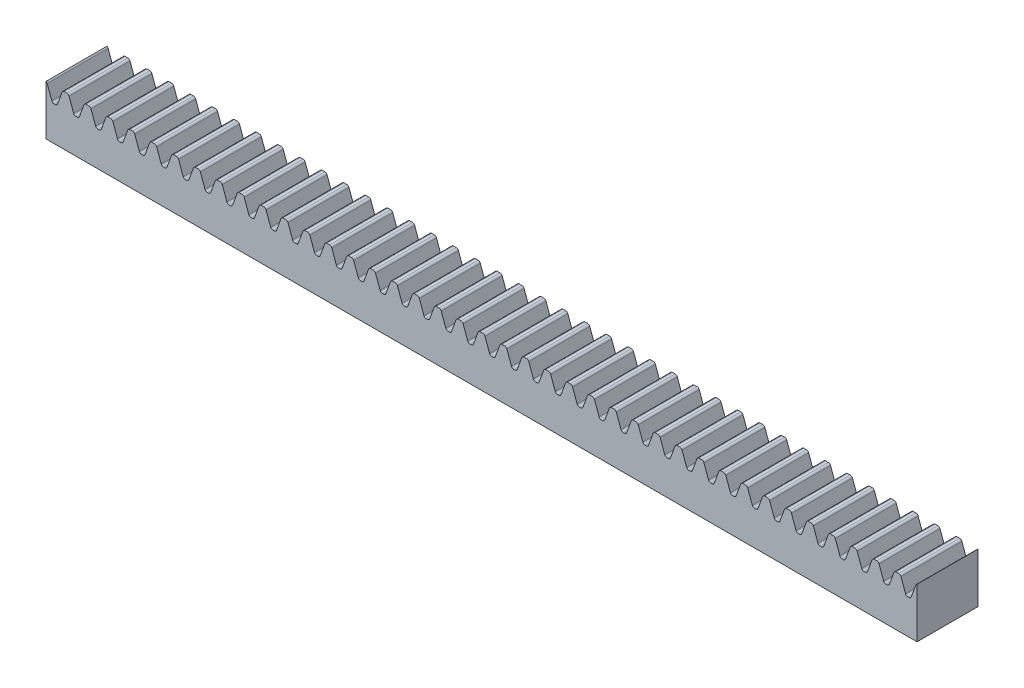
from build123d import *

# Parameters (mm, degrees)
BOSS_EXTRUDE1_DEPTH      = 4
BOSS_EXTRUDE1_DEPTH_BACK = 4
SKETCH3_W                = 100
SKETCH3_H                = 12.3
CUT_EXTRUDE1_DEPTH       = 51.535358908
LPATTERN1_COUNT          = 40
LPATTERN1_PITCH          = 2.513274123
LPATTERN1_COUNT_DIR2     = 2
LPATTERN1_PITCH_DIR2     = 2.513274123
SKETCH5_W                = 100
SKETCH5_H                = 8
CUT_EXTRUDE2_DEPTH       = 6.55
CUT_EXTRUDE3_START       = -1
CUT_EXTRUDE3_DEPTH       = 1


with BuildPart() as part:
    # Sketch3 → Boss-Extrude1 (new, two sides: drawn at the far end of the back side and taken through both)
    with BuildSketch(Plane.XY.offset(-BOSS_EXTRUDE1_DEPTH_BACK)):
        Rectangle(SKETCH3_W, SKETCH3_H)
    extrude(amount=BOSS_EXTRUDE1_DEPTH + BOSS_EXTRUDE1_DEPTH_BACK)

    # Sketch4 → Cut-Extrude1 (cut, symmetric)
    with BuildSketch(Plane.XY):
        with BuildLine():
            Line((-48.153629439, 5.973395556), (-48.089350678, 6.15))
            Line((-48.089350678, 6.15), (-49.008845396, 6.15))
            Line((-49.008845396, 6.15), (-49.008845396, 4.35))
            Line((-49.008845396, 4.35), (-48.932435624, 4.35))
            ThreePointArc((-48.932435624, 4.35), (-48.778485397, 4.39854032), (-48.680218339, 4.526604444))
            Line((-48.680218339, 4.526604444), (-48.153629439, 5.973395556))
        make_face()
        with BuildLine():
            Line((-47.901412154, 6.15), (-48.089350678, 6.15))
            Line((-48.089350678, 6.15), (-48.153629439, 5.973395556))
            ThreePointArc((-48.153629439, 5.973395556), (-48.05536238, 6.10145968), (-47.901412154, 6.15))
        make_face()
        with BuildLine():
            Line((-47.35078723, 5.973395556), (-47.415065991, 6.15))
            Line((-47.415065991, 6.15), (-47.603004515, 6.15))
            ThreePointArc((-47.603004515, 6.15), (-47.449054289, 6.10145968), (-47.35078723, 5.973395556))
        make_face()
        with BuildLine():
            Line((-46.495571273, 4.35), (-46.495571273, 6.15))
            Line((-46.495571273, 6.15), (-47.415065991, 6.15))
            Line((-47.415065991, 6.15), (-47.35078723, 5.973395556))
            Line((-47.35078723, 5.973395556), (-46.824198331, 4.526604444))
            ThreePointArc((-46.824198331, 4.526604444), (-46.725931272, 4.39854032), (-46.571981045, 4.35))
            Line((-46.571981045, 4.35), (-46.495571273, 4.35))
        make_face()
    cut_extrude1 = extrude(amount=CUT_EXTRUDE1_DEPTH, both=True, mode=Mode.SUBTRACT)

    # LPattern1: Cut-Extrude1 40 × 2
    with Locations(*[Vector(1, 0, 0) * (i * LPATTERN1_PITCH) + Vector(-1, 0, 0) * (j * LPATTERN1_PITCH_DIR2) for i in range(LPATTERN1_COUNT) for j in range(LPATTERN1_COUNT_DIR2) if (i, j) != (0, 0)]):
        add(cut_extrude1, mode=Mode.SUBTRACT)

    # Sketch5 → Cut-Extrude2 (cut)
    with BuildSketch(Plane.XZ.offset(6.15)):
        Rectangle(SKETCH5_W, SKETCH5_H)
    extrude(amount=-CUT_EXTRUDE2_DEPTH, mode=Mode.SUBTRACT)

    # Sketch6 → Cut-Extrude3 (cut)
    with BuildSketch(Plane(origin=(0, 0, -4), x_dir=(-1, 0, 0), z_dir=(0, 0, -1)).offset(CUT_EXTRUDE3_START)):
        with BuildLine():
            Line((-50, 0.4), (50, 0.4))
            Line((50, 0.4), (50, 6.123505047))
            ThreePointArc((50, 6.123505047), (49.917330087, 6.061763106), (49.864061353, 5.973395556))
            Line((49.864061353, 5.973395556), (49.337472453, 4.526604444))
            ThreePointArc((49.337472453, 4.526604444), (49.239205395, 4.39854032), (49.085255168, 4.35))
            Line((49.085255168, 4.35), (48.932435624, 4.35))
            ThreePointArc((48.932435624, 4.35), (48.778485397, 4.39854032), (48.680218339, 4.526604444))
            Line((48.680218339, 4.526604444), (48.153629439, 5.973395556))
            ThreePointArc((48.153629439, 5.973395556), (48.05536238, 6.10145968), (47.901412154, 6.15))
            Line((47.901412154, 6.15), (47.603004515, 6.15))
            ThreePointArc((47.603004515, 6.15), (47.449054289, 6.10145968), (47.35078723, 5.973395556))
            Line((47.35078723, 5.973395556), (46.824198331, 4.526604444))
            ThreePointArc((46.824198331, 4.526604444), (46.725931272, 4.39854032), (46.571981045, 4.35))
            Line((46.571981045, 4.35), (46.419161501, 4.35))
            ThreePointArc((46.419161501, 4.35), (46.265211275, 4.39854032), (46.166944216, 4.526604444))
            Line((46.166944216, 4.526604444), (45.640355316, 5.973395556))
            ThreePointArc((45.640355316, 5.973395556), (45.542088257, 6.10145968), (45.388138031, 6.15))
            Line((45.388138031, 6.15), (45.089730393, 6.15))
            ThreePointArc((45.089730393, 6.15), (44.935780166, 6.10145968), (44.837513107, 5.973395556))
            Line((44.837513107, 5.973395556), (44.310924208, 4.526604444))
            ThreePointArc((44.310924208, 4.526604444), (44.212657149, 4.39854032), (44.058706923, 4.35))
            Line((44.058706923, 4.35), (43.905887378, 4.35))
            ThreePointArc((43.905887378, 4.35), (43.751937152, 4.39854032), (43.653670093, 4.526604444))
            Line((43.653670093, 4.526604444), (43.127081193, 5.973395556))
            ThreePointArc((43.127081193, 5.973395556), (43.028814134, 6.10145968), (42.874863908, 6.15))
            Line((42.874863908, 6.15), (42.57645627, 6.15))
            ThreePointArc((42.57645627, 6.15), (42.422506043, 6.10145968), (42.324238985, 5.973395556))
            Line((42.324238985, 5.973395556), (41.797650085, 4.526604444))
            ThreePointArc((41.797650085, 4.526604444), (41.699383026, 4.39854032), (41.5454328, 4.35))
            Line((41.5454328, 4.35), (41.392613255, 4.35))
            ThreePointArc((41.392613255, 4.35), (41.238663029, 4.39854032), (41.14039597, 4.526604444))
            Line((41.14039597, 4.526604444), (40.61380707, 5.973395556))
            ThreePointArc((40.61380707, 5.973395556), (40.515540011, 6.10145968), (40.361589785, 6.15))
            Line((40.361589785, 6.15), (40.063182147, 6.15))
            ThreePointArc((40.063182147, 6.15), (39.909231921, 6.10145968), (39.810964862, 5.973395556))
            Line((39.810964862, 5.973395556), (39.284375962, 4.526604444))
            ThreePointArc((39.284375962, 4.526604444), (39.186108903, 4.39854032), (39.032158677, 4.35))
            Line((39.032158677, 4.35), (38.879339132, 4.35))
            ThreePointArc((38.879339132, 4.35), (38.725388906, 4.39854032), (38.627121847, 4.526604444))
            Line((38.627121847, 4.526604444), (38.100532947, 5.973395556))
            ThreePointArc((38.100532947, 5.973395556), (38.002265888, 6.10145968), (37.848315662, 6.15))
            Line((37.848315662, 6.15), (37.549908024, 6.15))
            ThreePointArc((37.549908024, 6.15), (37.395957798, 6.10145968), (37.297690739, 5.973395556))
            Line((37.297690739, 5.973395556), (36.771101839, 4.526604444))
            ThreePointArc((36.771101839, 4.526604444), (36.67283478, 4.39854032), (36.518884554, 4.35))
            Line((36.518884554, 4.35), (36.366065009, 4.35))
            ThreePointArc((36.366065009, 4.35), (36.212114783, 4.39854032), (36.113847724, 4.526604444))
            Line((36.113847724, 4.526604444), (35.587258824, 5.973395556))
            ThreePointArc((35.587258824, 5.973395556), (35.488991766, 6.10145968), (35.335041539, 6.15))
            Line((35.335041539, 6.15), (35.036633901, 6.15))
            ThreePointArc((35.036633901, 6.15), (34.882683675, 6.10145968), (34.784416616, 5.973395556))
            Line((34.784416616, 5.973395556), (34.257827716, 4.526604444))
            ThreePointArc((34.257827716, 4.526604444), (34.159560657, 4.39854032), (34.005610431, 4.35))
            Line((34.005610431, 4.35), (33.852790886, 4.35))
            ThreePointArc((33.852790886, 4.35), (33.69884066, 4.39854032), (33.600573601, 4.526604444))
            Line((33.600573601, 4.526604444), (33.073984702, 5.973395556))
            ThreePointArc((33.073984702, 5.973395556), (32.975717643, 6.10145968), (32.821767416, 6.15))
            Line((32.821767416, 6.15), (32.523359778, 6.15))
            ThreePointArc((32.523359778, 6.15), (32.369409552, 6.10145968), (32.271142493, 5.973395556))
            Line((32.271142493, 5.973395556), (31.744553593, 4.526604444))
            ThreePointArc((31.744553593, 4.526604444), (31.646286534, 4.39854032), (31.492336308, 4.35))
            Line((31.492336308, 4.35), (31.339516764, 4.35))
            ThreePointArc((31.339516764, 4.35), (31.185566537, 4.39854032), (31.087299478, 4.526604444))
            Line((31.087299478, 4.526604444), (30.560710579, 5.973395556))
            ThreePointArc((30.560710579, 5.973395556), (30.46244352, 6.10145968), (30.308493294, 6.15))
            Line((30.308493294, 6.15), (30.010085655, 6.15))
            ThreePointArc((30.010085655, 6.15), (29.856135429, 6.10145968), (29.75786837, 5.973395556))
            Line((29.75786837, 5.973395556), (29.23127947, 4.526604444))
            ThreePointArc((29.23127947, 4.526604444), (29.133012412, 4.39854032), (28.979062185, 4.35))
            Line((28.979062185, 4.35), (28.826242641, 4.35))
            ThreePointArc((28.826242641, 4.35), (28.672292414, 4.39854032), (28.574025356, 4.526604444))
            Line((28.574025356, 4.526604444), (28.047436456, 5.973395556))
            ThreePointArc((28.047436456, 5.973395556), (27.949169397, 6.10145968), (27.795219171, 6.15))
            Line((27.795219171, 6.15), (27.496811532, 6.15))
            ThreePointArc((27.496811532, 6.15), (27.342861306, 6.10145968), (27.244594247, 5.973395556))
            Line((27.244594247, 5.973395556), (26.718005348, 4.526604444))
            ThreePointArc((26.718005348, 4.526604444), (26.619738289, 4.39854032), (26.465788062, 4.35))
            Line((26.465788062, 4.35), (26.312968518, 4.35))
            ThreePointArc((26.312968518, 4.35), (26.159018292, 4.39854032), (26.060751233, 4.526604444))
            Line((26.060751233, 4.526604444), (25.534162333, 5.973395556))
            ThreePointArc((25.534162333, 5.973395556), (25.435895274, 6.10145968), (25.281945048, 6.15))
            Line((25.281945048, 6.15), (24.98353741, 6.15))
            ThreePointArc((24.98353741, 6.15), (24.829587183, 6.10145968), (24.731320124, 5.973395556))
            Line((24.731320124, 5.973395556), (24.204731225, 4.526604444))
            ThreePointArc((24.204731225, 4.526604444), (24.106464166, 4.39854032), (23.95251394, 4.35))
            Line((23.95251394, 4.35), (23.799694395, 4.35))
            ThreePointArc((23.799694395, 4.35), (23.645744169, 4.39854032), (23.54747711, 4.526604444))
            Line((23.54747711, 4.526604444), (23.02088821, 5.973395556))
            ThreePointArc((23.02088821, 5.973395556), (22.922621151, 6.10145968), (22.768670925, 6.15))
            Line((22.768670925, 6.15), (22.470263287, 6.15))
            ThreePointArc((22.470263287, 6.15), (22.31631306, 6.10145968), (22.218046002, 5.973395556))
            Line((22.218046002, 5.973395556), (21.691457102, 4.526604444))
            ThreePointArc((21.691457102, 4.526604444), (21.593190043, 4.39854032), (21.439239817, 4.35))
            Line((21.439239817, 4.35), (21.286420272, 4.35))
            ThreePointArc((21.286420272, 4.35), (21.132470046, 4.39854032), (21.034202987, 4.526604444))
            Line((21.034202987, 4.526604444), (20.507614087, 5.973395556))
            ThreePointArc((20.507614087, 5.973395556), (20.409347028, 6.10145968), (20.255396802, 6.15))
            Line((20.255396802, 6.15), (19.956989164, 6.15))
            ThreePointArc((19.956989164, 6.15), (19.803038938, 6.10145968), (19.704771879, 5.973395556))
            Line((19.704771879, 5.973395556), (19.178182979, 4.526604444))
            ThreePointArc((19.178182979, 4.526604444), (19.07991592, 4.39854032), (18.925965694, 4.35))
            Line((18.925965694, 4.35), (18.773146149, 4.35))
            ThreePointArc((18.773146149, 4.35), (18.619195923, 4.39854032), (18.520928864, 4.526604444))
            Line((18.520928864, 4.526604444), (17.994339964, 5.973395556))
            ThreePointArc((17.994339964, 5.973395556), (17.896072906, 6.10145968), (17.742122679, 6.15))
            Line((17.742122679, 6.15), (17.443715041, 6.15))
            ThreePointArc((17.443715041, 6.15), (17.289764815, 6.10145968), (17.191497756, 5.973395556))
            Line((17.191497756, 5.973395556), (16.664908856, 4.526604444))
            ThreePointArc((16.664908856, 4.526604444), (16.566641797, 4.39854032), (16.412691571, 4.35))
            Line((16.412691571, 4.35), (16.259872026, 4.35))
            ThreePointArc((16.259872026, 4.35), (16.1059218, 4.39854032), (16.007654741, 4.526604444))
            Line((16.007654741, 4.526604444), (15.481065842, 5.973395556))
            ThreePointArc((15.481065842, 5.973395556), (15.382798783, 6.10145968), (15.228848556, 6.15))
            Line((15.228848556, 6.15), (14.930440918, 6.15))
            ThreePointArc((14.930440918, 6.15), (14.776490692, 6.10145968), (14.678223633, 5.973395556))
            Line((14.678223633, 5.973395556), (14.151634733, 4.526604444))
            ThreePointArc((14.151634733, 4.526604444), (14.053367674, 4.39854032), (13.899417448, 4.35))
            Line((13.899417448, 4.35), (13.746597904, 4.35))
            ThreePointArc((13.746597904, 4.35), (13.592647677, 4.39854032), (13.494380618, 4.526604444))
            Line((13.494380618, 4.526604444), (12.967791719, 5.973395556))
            ThreePointArc((12.967791719, 5.973395556), (12.86952466, 6.10145968), (12.715574434, 6.15))
            Line((12.715574434, 6.15), (12.417166795, 6.15))
            ThreePointArc((12.417166795, 6.15), (12.263216569, 6.10145968), (12.16494951, 5.973395556))
            Line((12.16494951, 5.973395556), (11.63836061, 4.526604444))
            ThreePointArc((11.63836061, 4.526604444), (11.540093551, 4.39854032), (11.386143325, 4.35))
            Line((11.386143325, 4.35), (11.233323781, 4.35))
            ThreePointArc((11.233323781, 4.35), (11.079373554, 4.39854032), (10.981106496, 4.526604444))
            Line((10.981106496, 4.526604444), (10.454517596, 5.973395556))
            ThreePointArc((10.454517596, 5.973395556), (10.356250537, 6.10145968), (10.202300311, 6.15))
            Line((10.202300311, 6.15), (9.903892672, 6.15))
            ThreePointArc((9.903892672, 6.15), (9.749942446, 6.10145968), (9.651675387, 5.973395556))
            Line((9.651675387, 5.973395556), (9.125086487, 4.526604444))
            ThreePointArc((9.125086487, 4.526604444), (9.026819429, 4.39854032), (8.872869202, 4.35))
            Line((8.872869202, 4.35), (8.720049658, 4.35))
            ThreePointArc((8.720049658, 4.35), (8.566099431, 4.39854032), (8.467832373, 4.526604444))
            Line((8.467832373, 4.526604444), (7.941243473, 5.973395556))
            ThreePointArc((7.941243473, 5.973395556), (7.842976414, 6.10145968), (7.689026188, 6.15))
            Line((7.689026188, 6.15), (7.390618549, 6.15))
            ThreePointArc((7.390618549, 6.15), (7.236668323, 6.10145968), (7.138401264, 5.973395556))
            Line((7.138401264, 5.973395556), (6.611812365, 4.526604444))
            ThreePointArc((6.611812365, 4.526604444), (6.513545306, 4.39854032), (6.359595079, 4.35))
            Line((6.359595079, 4.35), (6.206775535, 4.35))
            ThreePointArc((6.206775535, 4.35), (6.052825309, 4.39854032), (5.95455825, 4.526604444))
            Line((5.95455825, 4.526604444), (5.42796935, 5.973395556))
            ThreePointArc((5.42796935, 5.973395556), (5.329702291, 6.10145968), (5.175752065, 6.15))
            Line((5.175752065, 6.15), (4.877344427, 6.15))
            ThreePointArc((4.877344427, 6.15), (4.7233942, 6.10145968), (4.625127141, 5.973395556))
            Line((4.625127141, 5.973395556), (4.098538242, 4.526604444))
            ThreePointArc((4.098538242, 4.526604444), (4.000271183, 4.39854032), (3.846320957, 4.35))
            Line((3.846320957, 4.35), (3.693501412, 4.35))
            ThreePointArc((3.693501412, 4.35), (3.539551186, 4.39854032), (3.441284127, 4.526604444))
            Line((3.441284127, 4.526604444), (2.914695227, 5.973395556))
            ThreePointArc((2.914695227, 5.973395556), (2.816428168, 6.10145968), (2.662477942, 6.15))
            Line((2.662477942, 6.15), (2.364070304, 6.15))
            ThreePointArc((2.364070304, 6.15), (2.210120077, 6.10145968), (2.111853019, 5.973395556))
            Line((2.111853019, 5.973395556), (1.585264119, 4.526604444))
            ThreePointArc((1.585264119, 4.526604444), (1.48699706, 4.39854032), (1.333046834, 4.35))
            Line((1.333046834, 4.35), (1.180227289, 4.35))
            ThreePointArc((1.180227289, 4.35), (1.026277063, 4.39854032), (0.928010004, 4.526604444))
            Line((0.928010004, 4.526604444), (0.401421104, 5.973395556))
            ThreePointArc((0.401421104, 5.973395556), (0.303154045, 6.10145968), (0.149203819, 6.15))
            Line((0.149203819, 6.15), (-0.149203819, 6.15))
            ThreePointArc((-0.149203819, 6.15), (-0.303154045, 6.10145968), (-0.401421104, 5.973395556))
            Line((-0.401421104, 5.973395556), (-0.928010004, 4.526604444))
            ThreePointArc((-0.928010004, 4.526604444), (-1.026277063, 4.39854032), (-1.180227289, 4.35))
            Line((-1.180227289, 4.35), (-1.333046834, 4.35))
            ThreePointArc((-1.333046834, 4.35), (-1.48699706, 4.39854032), (-1.585264119, 4.526604444))
            Line((-1.585264119, 4.526604444), (-2.111853019, 5.973395556))
            ThreePointArc((-2.111853019, 5.973395556), (-2.210120077, 6.10145968), (-2.364070304, 6.15))
            Line((-2.364070304, 6.15), (-2.662477942, 6.15))
            ThreePointArc((-2.662477942, 6.15), (-2.816428168, 6.10145968), (-2.914695227, 5.973395556))
            Line((-2.914695227, 5.973395556), (-3.441284127, 4.526604444))
            ThreePointArc((-3.441284127, 4.526604444), (-3.539551186, 4.39854032), (-3.693501412, 4.35))
            Line((-3.693501412, 4.35), (-3.846320957, 4.35))
            ThreePointArc((-3.846320957, 4.35), (-4.000271183, 4.39854032), (-4.098538242, 4.526604444))
            Line((-4.098538242, 4.526604444), (-4.625127141, 5.973395556))
            ThreePointArc((-4.625127141, 5.973395556), (-4.7233942, 6.10145968), (-4.877344427, 6.15))
            Line((-4.877344427, 6.15), (-5.175752065, 6.15))
            ThreePointArc((-5.175752065, 6.15), (-5.329702291, 6.10145968), (-5.42796935, 5.973395556))
            Line((-5.42796935, 5.973395556), (-5.95455825, 4.526604444))
            ThreePointArc((-5.95455825, 4.526604444), (-6.052825309, 4.39854032), (-6.206775535, 4.35))
            Line((-6.206775535, 4.35), (-6.359595079, 4.35))
            ThreePointArc((-6.359595079, 4.35), (-6.513545306, 4.39854032), (-6.611812365, 4.526604444))
            Line((-6.611812365, 4.526604444), (-7.138401264, 5.973395556))
            ThreePointArc((-7.138401264, 5.973395556), (-7.236668323, 6.10145968), (-7.390618549, 6.15))
            Line((-7.390618549, 6.15), (-7.689026188, 6.15))
            ThreePointArc((-7.689026188, 6.15), (-7.842976414, 6.10145968), (-7.941243473, 5.973395556))
            Line((-7.941243473, 5.973395556), (-8.467832373, 4.526604444))
            ThreePointArc((-8.467832373, 4.526604444), (-8.566099431, 4.39854032), (-8.720049658, 4.35))
            Line((-8.720049658, 4.35), (-8.872869202, 4.35))
            ThreePointArc((-8.872869202, 4.35), (-9.026819429, 4.39854032), (-9.125086487, 4.526604444))
            Line((-9.125086487, 4.526604444), (-9.651675387, 5.973395556))
            ThreePointArc((-9.651675387, 5.973395556), (-9.749942446, 6.10145968), (-9.903892672, 6.15))
            Line((-9.903892672, 6.15), (-10.202300311, 6.15))
            ThreePointArc((-10.202300311, 6.15), (-10.356250537, 6.10145968), (-10.454517596, 5.973395556))
            Line((-10.454517596, 5.973395556), (-10.981106496, 4.526604444))
            ThreePointArc((-10.981106496, 4.526604444), (-11.079373554, 4.39854032), (-11.233323781, 4.35))
            Line((-11.233323781, 4.35), (-11.386143325, 4.35))
            ThreePointArc((-11.386143325, 4.35), (-11.540093551, 4.39854032), (-11.63836061, 4.526604444))
            Line((-11.63836061, 4.526604444), (-12.16494951, 5.973395556))
            ThreePointArc((-12.16494951, 5.973395556), (-12.263216569, 6.10145968), (-12.417166795, 6.15))
            Line((-12.417166795, 6.15), (-12.715574434, 6.15))
            ThreePointArc((-12.715574434, 6.15), (-12.86952466, 6.10145968), (-12.967791719, 5.973395556))
            Line((-12.967791719, 5.973395556), (-13.494380618, 4.526604444))
            ThreePointArc((-13.494380618, 4.526604444), (-13.592647677, 4.39854032), (-13.746597904, 4.35))
            Line((-13.746597904, 4.35), (-13.899417448, 4.35))
            ThreePointArc((-13.899417448, 4.35), (-14.053367674, 4.39854032), (-14.151634733, 4.526604444))
            Line((-14.151634733, 4.526604444), (-14.678223633, 5.973395556))
            ThreePointArc((-14.678223633, 5.973395556), (-14.776490692, 6.10145968), (-14.930440918, 6.15))
            Line((-14.930440918, 6.15), (-15.228848556, 6.15))
            ThreePointArc((-15.228848556, 6.15), (-15.382798783, 6.10145968), (-15.481065842, 5.973395556))
            Line((-15.481065842, 5.973395556), (-16.007654741, 4.526604444))
            ThreePointArc((-16.007654741, 4.526604444), (-16.1059218, 4.39854032), (-16.259872026, 4.35))
            Line((-16.259872026, 4.35), (-16.412691571, 4.35))
            ThreePointArc((-16.412691571, 4.35), (-16.566641797, 4.39854032), (-16.664908856, 4.526604444))
            Line((-16.664908856, 4.526604444), (-17.191497756, 5.973395556))
            ThreePointArc((-17.191497756, 5.973395556), (-17.289764815, 6.10145968), (-17.443715041, 6.15))
            Line((-17.443715041, 6.15), (-17.742122679, 6.15))
            ThreePointArc((-17.742122679, 6.15), (-17.896072906, 6.10145968), (-17.994339964, 5.973395556))
            Line((-17.994339964, 5.973395556), (-18.520928864, 4.526604444))
            ThreePointArc((-18.520928864, 4.526604444), (-18.619195923, 4.39854032), (-18.773146149, 4.35))
            Line((-18.773146149, 4.35), (-18.925965694, 4.35))
            ThreePointArc((-18.925965694, 4.35), (-19.07991592, 4.39854032), (-19.178182979, 4.526604444))
            Line((-19.178182979, 4.526604444), (-19.704771879, 5.973395556))
            ThreePointArc((-19.704771879, 5.973395556), (-19.803038938, 6.10145968), (-19.956989164, 6.15))
            Line((-19.956989164, 6.15), (-20.255396802, 6.15))
            ThreePointArc((-20.255396802, 6.15), (-20.409347028, 6.10145968), (-20.507614087, 5.973395556))
            Line((-20.507614087, 5.973395556), (-21.034202987, 4.526604444))
            ThreePointArc((-21.034202987, 4.526604444), (-21.132470046, 4.39854032), (-21.286420272, 4.35))
            Line((-21.286420272, 4.35), (-21.439239817, 4.35))
            ThreePointArc((-21.439239817, 4.35), (-21.593190043, 4.39854032), (-21.691457102, 4.526604444))
            Line((-21.691457102, 4.526604444), (-22.218046002, 5.973395556))
            ThreePointArc((-22.218046002, 5.973395556), (-22.31631306, 6.10145968), (-22.470263287, 6.15))
            Line((-22.470263287, 6.15), (-22.768670925, 6.15))
            ThreePointArc((-22.768670925, 6.15), (-22.922621151, 6.10145968), (-23.02088821, 5.973395556))
            Line((-23.02088821, 5.973395556), (-23.54747711, 4.526604444))
            ThreePointArc((-23.54747711, 4.526604444), (-23.645744169, 4.39854032), (-23.799694395, 4.35))
            Line((-23.799694395, 4.35), (-23.95251394, 4.35))
            ThreePointArc((-23.95251394, 4.35), (-24.106464166, 4.39854032), (-24.204731225, 4.526604444))
            Line((-24.204731225, 4.526604444), (-24.731320124, 5.973395556))
            ThreePointArc((-24.731320124, 5.973395556), (-24.829587183, 6.10145968), (-24.98353741, 6.15))
            Line((-24.98353741, 6.15), (-25.281945048, 6.15))
            ThreePointArc((-25.281945048, 6.15), (-25.435895274, 6.10145968), (-25.534162333, 5.973395556))
            Line((-25.534162333, 5.973395556), (-26.060751233, 4.526604444))
            ThreePointArc((-26.060751233, 4.526604444), (-26.159018292, 4.39854032), (-26.312968518, 4.35))
            Line((-26.312968518, 4.35), (-26.465788062, 4.35))
            ThreePointArc((-26.465788062, 4.35), (-26.619738289, 4.39854032), (-26.718005348, 4.526604444))
            Line((-26.718005348, 4.526604444), (-27.244594247, 5.973395556))
            ThreePointArc((-27.244594247, 5.973395556), (-27.342861306, 6.10145968), (-27.496811532, 6.15))
            Line((-27.496811532, 6.15), (-27.795219171, 6.15))
            ThreePointArc((-27.795219171, 6.15), (-27.949169397, 6.10145968), (-28.047436456, 5.973395556))
            Line((-28.047436456, 5.973395556), (-28.574025356, 4.526604444))
            ThreePointArc((-28.574025356, 4.526604444), (-28.672292414, 4.39854032), (-28.826242641, 4.35))
            Line((-28.826242641, 4.35), (-28.979062185, 4.35))
            ThreePointArc((-28.979062185, 4.35), (-29.133012412, 4.39854032), (-29.23127947, 4.526604444))
            Line((-29.23127947, 4.526604444), (-29.75786837, 5.973395556))
            ThreePointArc((-29.75786837, 5.973395556), (-29.856135429, 6.10145968), (-30.010085655, 6.15))
            Line((-30.010085655, 6.15), (-30.308493294, 6.15))
            ThreePointArc((-30.308493294, 6.15), (-30.46244352, 6.10145968), (-30.560710579, 5.973395556))
            Line((-30.560710579, 5.973395556), (-31.087299478, 4.526604444))
            ThreePointArc((-31.087299478, 4.526604444), (-31.185566537, 4.39854032), (-31.339516764, 4.35))
            Line((-31.339516764, 4.35), (-31.492336308, 4.35))
            ThreePointArc((-31.492336308, 4.35), (-31.646286534, 4.39854032), (-31.744553593, 4.526604444))
            Line((-31.744553593, 4.526604444), (-32.271142493, 5.973395556))
            ThreePointArc((-32.271142493, 5.973395556), (-32.369409552, 6.10145968), (-32.523359778, 6.15))
            Line((-32.523359778, 6.15), (-32.821767416, 6.15))
            ThreePointArc((-32.821767416, 6.15), (-32.975717643, 6.10145968), (-33.073984702, 5.973395556))
            Line((-33.073984702, 5.973395556), (-33.600573601, 4.526604444))
            ThreePointArc((-33.600573601, 4.526604444), (-33.69884066, 4.39854032), (-33.852790886, 4.35))
            Line((-33.852790886, 4.35), (-34.005610431, 4.35))
            ThreePointArc((-34.005610431, 4.35), (-34.159560657, 4.39854032), (-34.257827716, 4.526604444))
            Line((-34.257827716, 4.526604444), (-34.784416616, 5.973395556))
            ThreePointArc((-34.784416616, 5.973395556), (-34.882683675, 6.10145968), (-35.036633901, 6.15))
            Line((-35.036633901, 6.15), (-35.335041539, 6.15))
            ThreePointArc((-35.335041539, 6.15), (-35.488991766, 6.10145968), (-35.587258824, 5.973395556))
            Line((-35.587258824, 5.973395556), (-36.113847724, 4.526604444))
            ThreePointArc((-36.113847724, 4.526604444), (-36.212114783, 4.39854032), (-36.366065009, 4.35))
            Line((-36.366065009, 4.35), (-36.518884554, 4.35))
            ThreePointArc((-36.518884554, 4.35), (-36.67283478, 4.39854032), (-36.771101839, 4.526604444))
            Line((-36.771101839, 4.526604444), (-37.297690739, 5.973395556))
            ThreePointArc((-37.297690739, 5.973395556), (-37.395957798, 6.10145968), (-37.549908024, 6.15))
            Line((-37.549908024, 6.15), (-37.848315662, 6.15))
            ThreePointArc((-37.848315662, 6.15), (-38.002265888, 6.10145968), (-38.100532947, 5.973395556))
            Line((-38.100532947, 5.973395556), (-38.627121847, 4.526604444))
            ThreePointArc((-38.627121847, 4.526604444), (-38.725388906, 4.39854032), (-38.879339132, 4.35))
            Line((-38.879339132, 4.35), (-39.032158677, 4.35))
            ThreePointArc((-39.032158677, 4.35), (-39.186108903, 4.39854032), (-39.284375962, 4.526604444))
            Line((-39.284375962, 4.526604444), (-39.810964862, 5.973395556))
            ThreePointArc((-39.810964862, 5.973395556), (-39.909231921, 6.10145968), (-40.063182147, 6.15))
            Line((-40.063182147, 6.15), (-40.361589785, 6.15))
            ThreePointArc((-40.361589785, 6.15), (-40.515540011, 6.10145968), (-40.61380707, 5.973395556))
            Line((-40.61380707, 5.973395556), (-41.14039597, 4.526604444))
            ThreePointArc((-41.14039597, 4.526604444), (-41.238663029, 4.39854032), (-41.392613255, 4.35))
            Line((-41.392613255, 4.35), (-41.5454328, 4.35))
            ThreePointArc((-41.5454328, 4.35), (-41.699383026, 4.39854032), (-41.797650085, 4.526604444))
            Line((-41.797650085, 4.526604444), (-42.324238985, 5.973395556))
            ThreePointArc((-42.324238985, 5.973395556), (-42.422506043, 6.10145968), (-42.57645627, 6.15))
            Line((-42.57645627, 6.15), (-42.874863908, 6.15))
            ThreePointArc((-42.874863908, 6.15), (-43.028814134, 6.10145968), (-43.127081193, 5.973395556))
            Line((-43.127081193, 5.973395556), (-43.653670093, 4.526604444))
            ThreePointArc((-43.653670093, 4.526604444), (-43.751937152, 4.39854032), (-43.905887378, 4.35))
            Line((-43.905887378, 4.35), (-44.058706923, 4.35))
            ThreePointArc((-44.058706923, 4.35), (-44.212657149, 4.39854032), (-44.310924208, 4.526604444))
            Line((-44.310924208, 4.526604444), (-44.837513107, 5.973395556))
            ThreePointArc((-44.837513107, 5.973395556), (-44.935780166, 6.10145968), (-45.089730393, 6.15))
            Line((-45.089730393, 6.15), (-45.388138031, 6.15))
            ThreePointArc((-45.388138031, 6.15), (-45.542088257, 6.10145968), (-45.640355316, 5.973395556))
            Line((-45.640355316, 5.973395556), (-46.166944216, 4.526604444))
            ThreePointArc((-46.166944216, 4.526604444), (-46.265211275, 4.39854032), (-46.419161501, 4.35))
            Line((-46.419161501, 4.35), (-46.571981045, 4.35))
            ThreePointArc((-46.571981045, 4.35), (-46.725931272, 4.39854032), (-46.824198331, 4.526604444))
            Line((-46.824198331, 4.526604444), (-47.35078723, 5.973395556))
            ThreePointArc((-47.35078723, 5.973395556), (-47.449054289, 6.10145968), (-47.603004515, 6.15))
            Line((-47.603004515, 6.15), (-47.901412154, 6.15))
            ThreePointArc((-47.901412154, 6.15), (-48.05536238, 6.10145968), (-48.153629439, 5.973395556))
            Line((-48.153629439, 5.973395556), (-48.680218339, 4.526604444))
            ThreePointArc((-48.680218339, 4.526604444), (-48.778485397, 4.39854032), (-48.932435624, 4.35))
            Line((-48.932435624, 4.35), (-49.085255168, 4.35))
            ThreePointArc((-49.085255168, 4.35), (-49.239205395, 4.39854032), (-49.337472453, 4.526604444))
            Line((-49.337472453, 4.526604444), (-49.864061353, 5.973395556))
            ThreePointArc((-49.864061353, 5.973395556), (-49.917330087, 6.061763106), (-50, 6.123505047))
            Line((-50, 6.123505047), (-50, 0.4))
        make_face()
    extrude(amount=CUT_EXTRUDE3_DEPTH, mode=Mode.SUBTRACT)


solid = part.part
